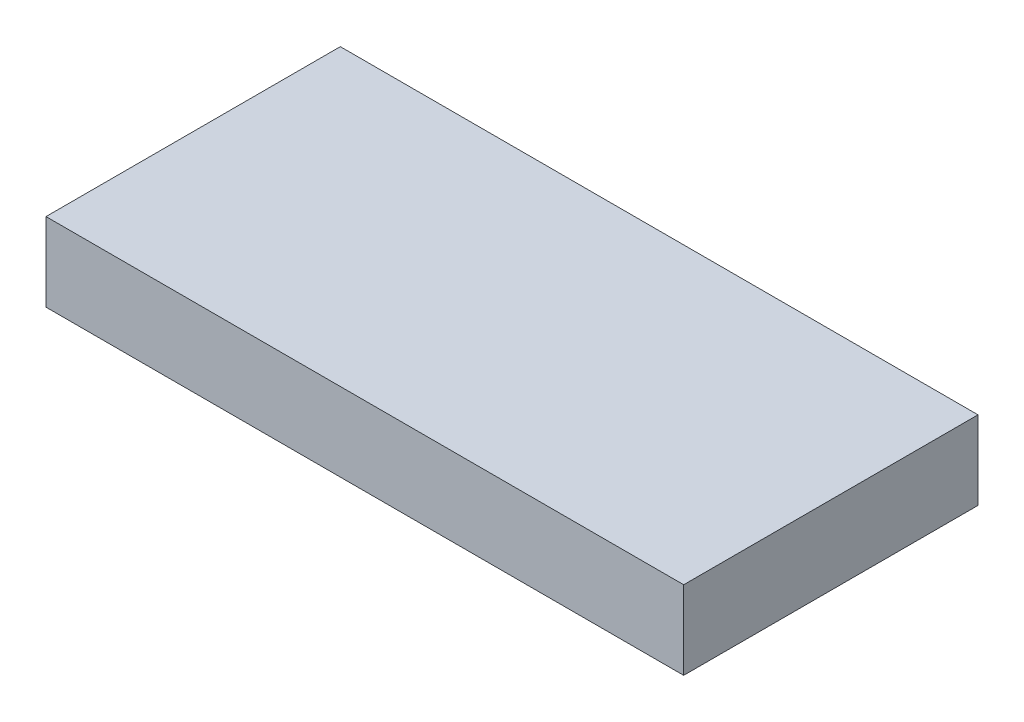
from build123d import *

# Parameters (mm, degrees)
SKETCH_1_W      = 65
SKETCH_1_H      = 30
EXTRUDE_1_DEPTH = 8


with BuildPart() as part:
    # 草图1 → 凸台-拉伸1 (new body)
    with BuildSketch(Plane(origin=(0, 0, 0), x_dir=(1, 0, 0), z_dir=(0, 1, 0))):
        Rectangle(SKETCH_1_W, SKETCH_1_H)
    extrude(amount=EXTRUDE_1_DEPTH)


solid = part.part
